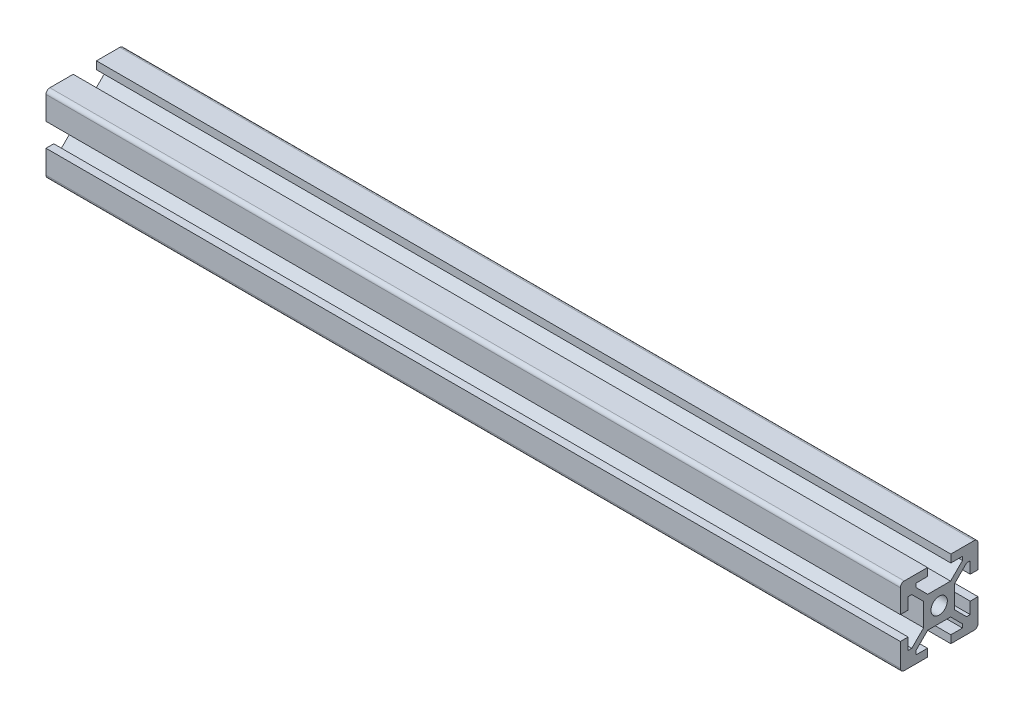
from build123d import *

# Parameters (mm, degrees)
SKETCH1_R           = 2.1
BOSS_EXTRUDE1_DEPTH = 220


with BuildPart() as part:
    # Sketch1 → Boss-Extrude1 (new body)
    with BuildSketch(Plane(origin=(0, 0, 0), x_dir=(0, 0, -1), z_dir=(1, 0, 0))):
        with BuildLine():
            Line((-10, 9), (-10, 3))
            Line((-10, 3), (-8, 3))
            Line((-8, 3), (-8, 6))
            Line((-8, 6), (-7.060660172, 6))
            Line((-7.060660172, 6), (-4, 2.939339828))
            Line((-4, 2.939339828), (-4, -2.939339828))
            Line((-4, -2.939339828), (-7.060660172, -6))
            Line((-7.060660172, -6), (-8, -6))
            Line((-8, -6), (-8, -3))
            Line((-8, -3), (-10, -3))
            Line((-10, -3), (-10, -9))
            ThreePointArc((-10, -9), (-9.707106781, -9.707106781), (-9, -10))
            Line((-9, -10), (-3, -10))
            Line((-3, -10), (-3, -8))
            Line((-3, -8), (-6, -8))
            Line((-6, -8), (-6, -7.060660172))
            Line((-6, -7.060660172), (-2.939339828, -4))
            Line((-2.939339828, -4), (2.939339828, -4))
            Line((2.939339828, -4), (6, -7.060660172))
            Line((6, -7.060660172), (6, -8))
            Line((6, -8), (3, -8))
            Line((3, -8), (3, -10))
            Line((3, -10), (9, -10))
            ThreePointArc((9, -10), (9.707106781, -9.707106781), (10, -9))
            Line((10, -9), (10, -3))
            Line((10, -3), (8, -3))
            Line((8, -3), (8, -6))
            Line((8, -6), (7.060660172, -6))
            Line((7.060660172, -6), (4, -2.939339828))
            Line((4, -2.939339828), (4, 2.939339828))
            Line((4, 2.939339828), (7.060660172, 6))
            Line((7.060660172, 6), (8, 6))
            Line((8, 6), (8, 3))
            Line((8, 3), (10, 3))
            Line((10, 3), (10, 9))
            ThreePointArc((10, 9), (9.707106781, 9.707106781), (9, 10))
            Line((9, 10), (3, 10))
            Line((3, 10), (3, 8))
            Line((3, 8), (6, 8))
            Line((6, 8), (6, 7.060660172))
            Line((6, 7.060660172), (2.939339828, 4))
            Line((2.939339828, 4), (-2.939339828, 4))
            Line((-2.939339828, 4), (-6, 7.060660172))
            Line((-6, 7.060660172), (-6, 8))
            Line((-6, 8), (-3, 8))
            Line((-3, 8), (-3, 10))
            Line((-3, 10), (-9, 10))
            ThreePointArc((-9, 10), (-9.707106781, 9.707106781), (-10, 9))
        make_face()
        Circle(SKETCH1_R, mode=Mode.SUBTRACT)
    extrude(amount=BOSS_EXTRUDE1_DEPTH)


solid = part.part
